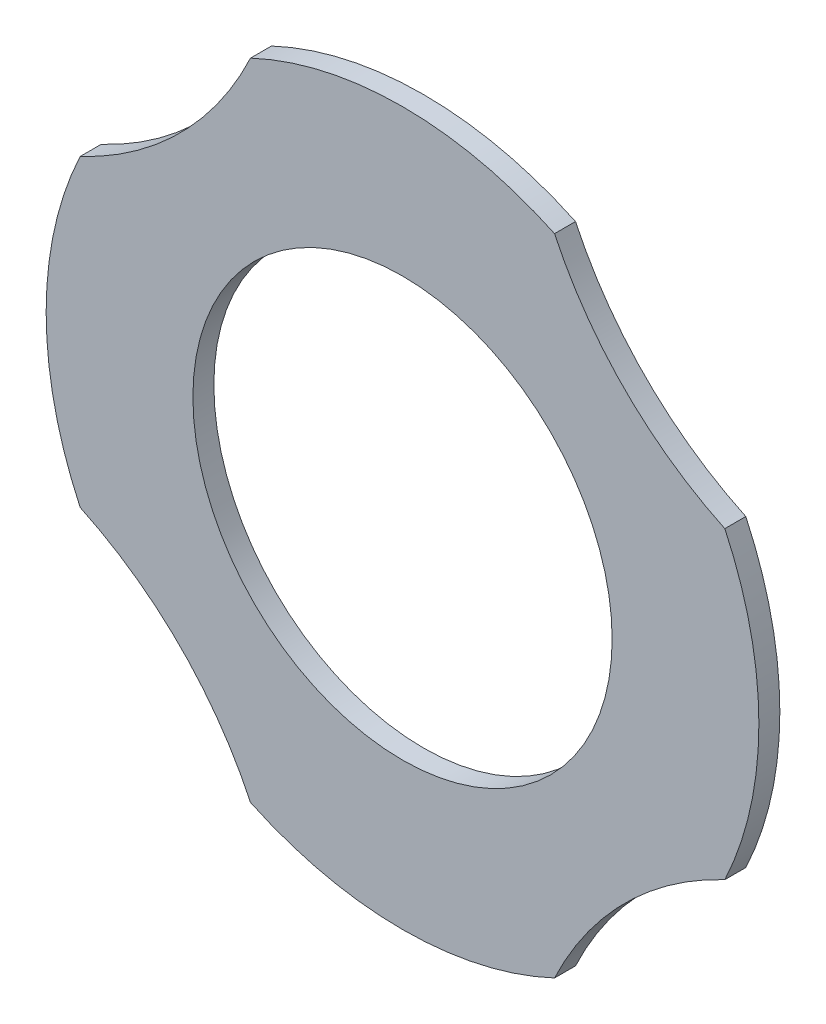
from build123d import *

# Parameters (mm, degrees)
SALIENTE_EXTRUIR1_DEPTH = 10
CROQUIS2_R              = 100
CORTAR_EXTRUIR1_DEPTH   = 10


with BuildPart() as part:
    # Croquis1 → Saliente-Extruir1 (new body)
    with BuildSketch(Plane.XY):
        with BuildLine():
            ThreePointArc((-72.516892967, 473.757277013), (0, 490), (72.516892967, 473.757277013))
            ThreePointArc((72.516892967, 473.757277013), (106.066017178, 426.066017178), (153.757277013, 392.516892967))
            ThreePointArc((153.757277013, 392.516892967), (170, 320), (153.757277013, 247.483107033))
            ThreePointArc((153.757277013, 247.483107033), (106.066017178, 213.933982822), (72.516892967, 166.242722987))
            ThreePointArc((72.516892967, 166.242722987), (0, 150), (-72.516892967, 166.242722987))
            ThreePointArc((-72.516892967, 166.242722987), (-106.066017178, 213.933982822), (-153.757277013, 247.483107033))
            ThreePointArc((-153.757277013, 247.483107033), (-170, 320), (-153.757277013, 392.516892967))
            ThreePointArc((-153.757277013, 392.516892967), (-106.066017178, 426.066017178), (-72.516892967, 473.757277013))
        make_face()
    extrude(amount=SALIENTE_EXTRUIR1_DEPTH)

    # Croquis2 → Cortar-Extruir1 (cut)
    with BuildSketch(Plane.XY.offset(10)):
        with Locations((0, 320)):
            Circle(CROQUIS2_R)
    extrude(amount=-CORTAR_EXTRUIR1_DEPTH, mode=Mode.SUBTRACT)


solid = part.part
